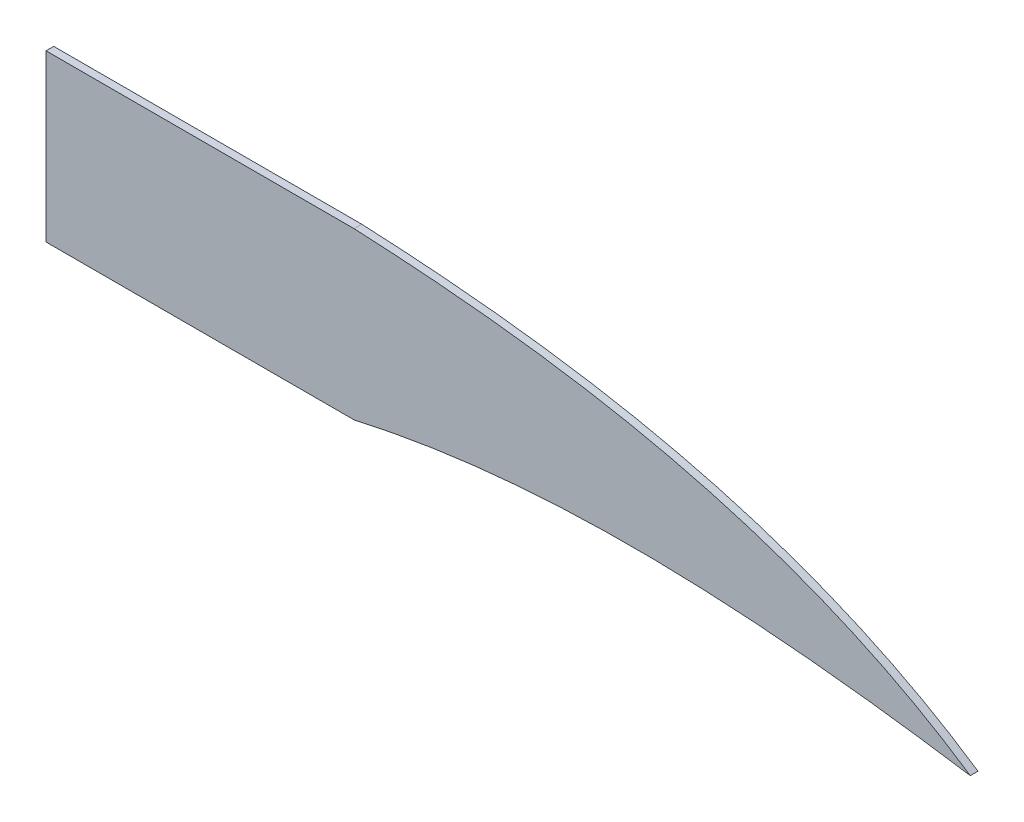
from build123d import *

# Parameters (mm, degrees)
BOSS_EXTRUDE1_DEPTH = 2


with BuildPart() as part:
    # Sketch1 → Boss-Extrude1 (new body)
    with BuildSketch(Plane.XY):
        with BuildLine():
            Line((-120, 21.5), (-40, 21.5))
            add(Edge.make_bspline(
                [(-40, 21.5), (15.075510425, 18.925789545), (73.253217354, 10.030346032), (120, -21.5)],
                knots=[0, 0, 0, 0, 1, 1, 1, 1], degree=3))
            add(Edge.make_bspline(
                [(-40, -21.5), (12.778539399, -9.52302093), (67.141346764, -13.406218695), (120, -21.5)],
                knots=[0, 0, 0, 0, 1, 1, 1, 1], degree=3))
            Line((-40, -21.5), (-120, -21.5))
            Line((-120, -21.5), (-120, 21.5))
        make_face()
    extrude(amount=BOSS_EXTRUDE1_DEPTH)


solid = part.part
